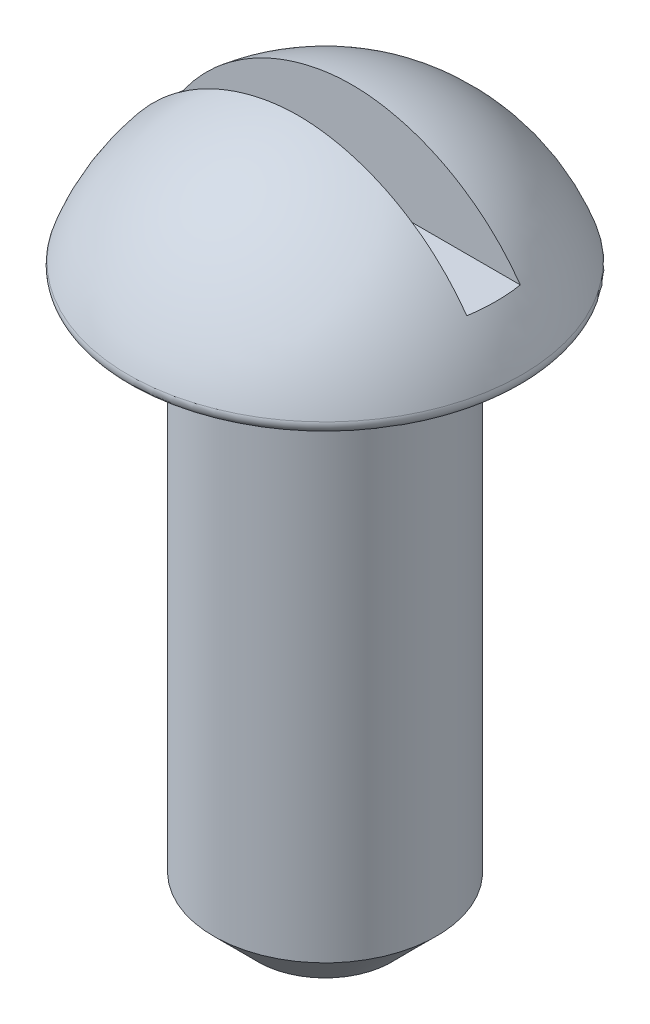
from build123d import *

# Parameters (mm, degrees)
SKETCH_13_W         = 4.5
SKETCH_13_H         = 0.6
CUT_EXTRUDE_9_DEPTH = 1
FILLET_1_R          = 0.1
CHAMFER_1_SIZE      = 0.5


with BuildPart() as part:
    # Эскиз1 → Повернуть1 (revolve)
    with BuildSketch(Plane.XY):
        with BuildLine():
            Line((1.25, 90.535042223), (2.25, 90.535042223))
            ThreePointArc((2.25, 90.535042223), (1.523658588, 91.67026825), (0.3, 92.235042223))
            Line((0.3, 92.235042223), (0, 92.235042223))
            Line((0, 92.235042223), (0, 84.235646063))
            Line((0, 84.235646063), (1.25, 84.235646063))
            Line((1.25, 84.235646063), (1.25, 90.535042223))
        make_face()
    revolve(axis=Axis((0, 125.763182898, 0), (0, -1, 0)))

    # Эскиз13 → Вырез-Вытянуть9 (cut)
    with BuildSketch(Plane(origin=(0, 92.235042223, 0), x_dir=(-1, 0, 0), z_dir=(0, 1, 0))):
        Rectangle(SKETCH_13_W, SKETCH_13_H)
    extrude(amount=-CUT_EXTRUDE_9_DEPTH, mode=Mode.SUBTRACT)

    # Скругление1
    fillet_1_edges = [part.edges().sort_by_distance(p)[0] for p in [
        (-2.25, 90.535042223, 0),
    ]]
    fillet(fillet_1_edges, radius=FILLET_1_R)

    # Фаска1
    chamfer_1_edges = [part.edges().sort_by_distance(p)[0] for p in [
        (-1.25, 84.235646063, 0),
    ]]
    chamfer(chamfer_1_edges, length=CHAMFER_1_SIZE)


solid = part.part
